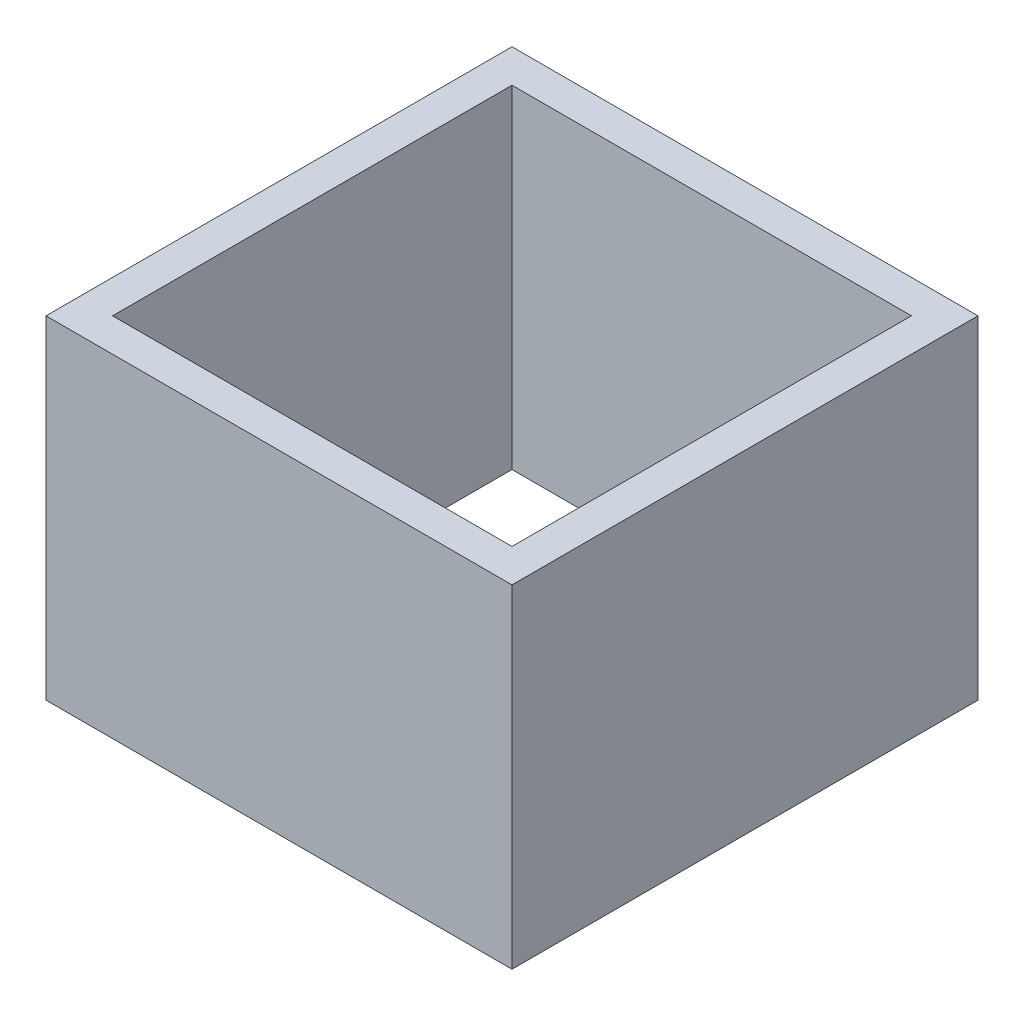
from build123d import *

# Parameters (mm, degrees)
SKETCH1_W           = 88.9
SKETCH1_H           = 88.9
BOSS_EXTRUDE1_DEPTH = 63.5
SKETCH2_W           = 76.2
SKETCH2_H           = 76.2
CUT_EXTRUDE1_DEPTH  = 90.352420225


with BuildPart() as part:
    # Sketch1 → Boss-Extrude1 (new body)
    with BuildSketch(Plane(origin=(0, 0, 0), x_dir=(1, 0, 0), z_dir=(0, 1, 0))):
        Rectangle(SKETCH1_W, SKETCH1_H)
    extrude(amount=BOSS_EXTRUDE1_DEPTH)

    # Sketch2 → Cut-Extrude1 (cut, through all)
    with BuildSketch(Plane(origin=(0, 0, 0), x_dir=(1, 0, 0), z_dir=(0, 1, 0))):
        Rectangle(SKETCH2_W, SKETCH2_H)
    extrude(amount=CUT_EXTRUDE1_DEPTH, mode=Mode.SUBTRACT)


solid = part.part
